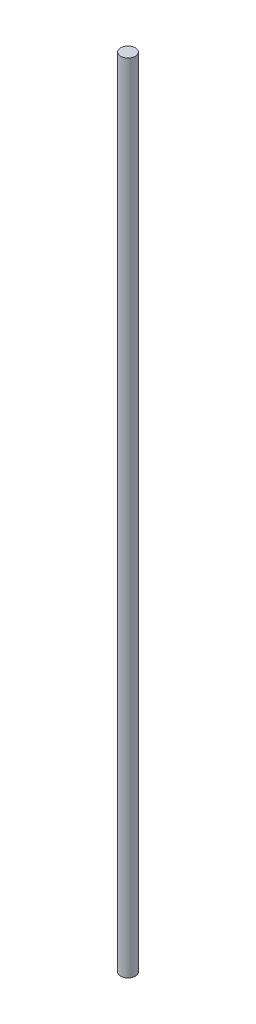
from build123d import *


with BuildPart() as part:
    # Sketch1 → Revolve-Thin1 (revolve)
    with BuildSketch(Plane.XY, mode=Mode.PRIVATE) as revolve_thin1_sk:
        Polygon((0, -5160.635390525), (6, -5160.635390525), (6, -5810.635390525), (0, -5810.635390525), (0, -5808.095390525), (3.46, -5808.095390525), (3.46, -5163.175390525), (0, -5163.175390525), align=None)
    revolve(revolve_thin1_sk.sketch.rotate(Axis((0, 5487.180537772, 0), (0, -1, 0)), 90), axis=Axis((0, 5487.180537772, 0), (0, -1, 0)))


solid = part.part
